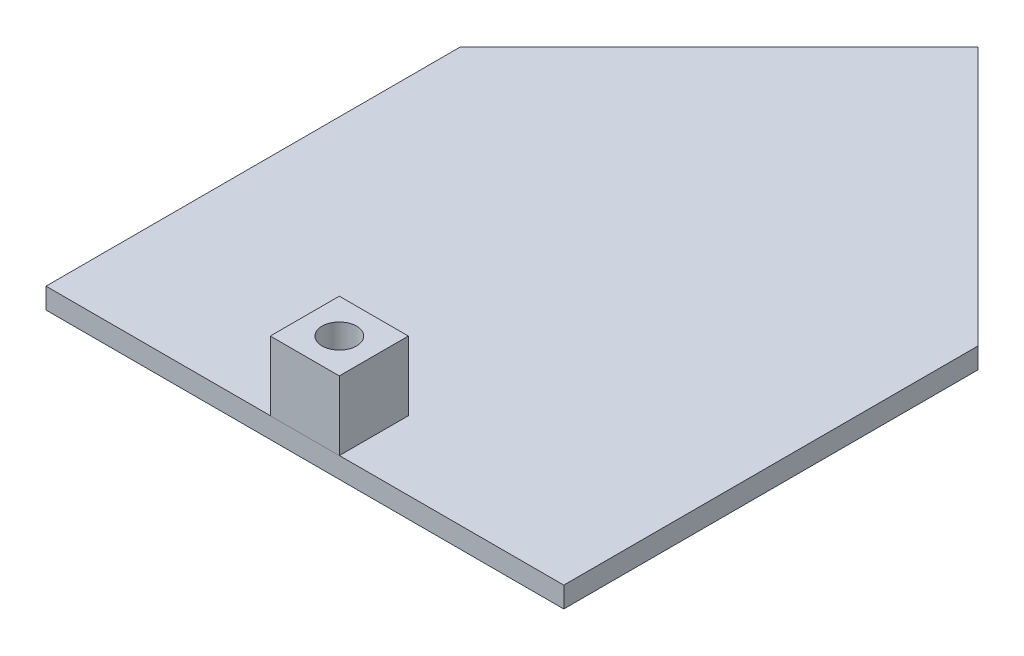
from build123d import *

# Parameters (mm, degrees)
BOSS_EXTRUDE1_DEPTH = 6
SKETCH2_W           = 20
SKETCH2_H           = 20
SKETCH2_R           = 5
BOSS_EXTRUDE2_DEPTH = 20


with BuildPart() as part:
    # Sketch1 → Boss-Extrude1 (new body)
    with BuildSketch(Plane(origin=(0, 0, 0), x_dir=(1, 0, 0), z_dir=(0, 1, 0))):
        Polygon((-34.039277024, -34.17435352), (115.960722976, -34.17435352), (115.960722976, 85.82564648), (40.960722976, 160.82564648), (-34.039277024, 85.82564648), align=None)
    extrude(amount=BOSS_EXTRUDE1_DEPTH)

    # Sketch2 → Boss-Extrude2 (add)
    with BuildSketch(Plane(origin=(0, 6, 0), x_dir=(1, 0, 0), z_dir=(0, 1, 0))):
        with Locations((40.960722976, -24.206365995)):
            Rectangle(SKETCH2_W, SKETCH2_H)
        with Locations(Location((40.960722976, -24.206365995, 0), (0, 0, 270))):
            Circle(SKETCH2_R, mode=Mode.SUBTRACT)
    extrude(amount=BOSS_EXTRUDE2_DEPTH)


solid = part.part
